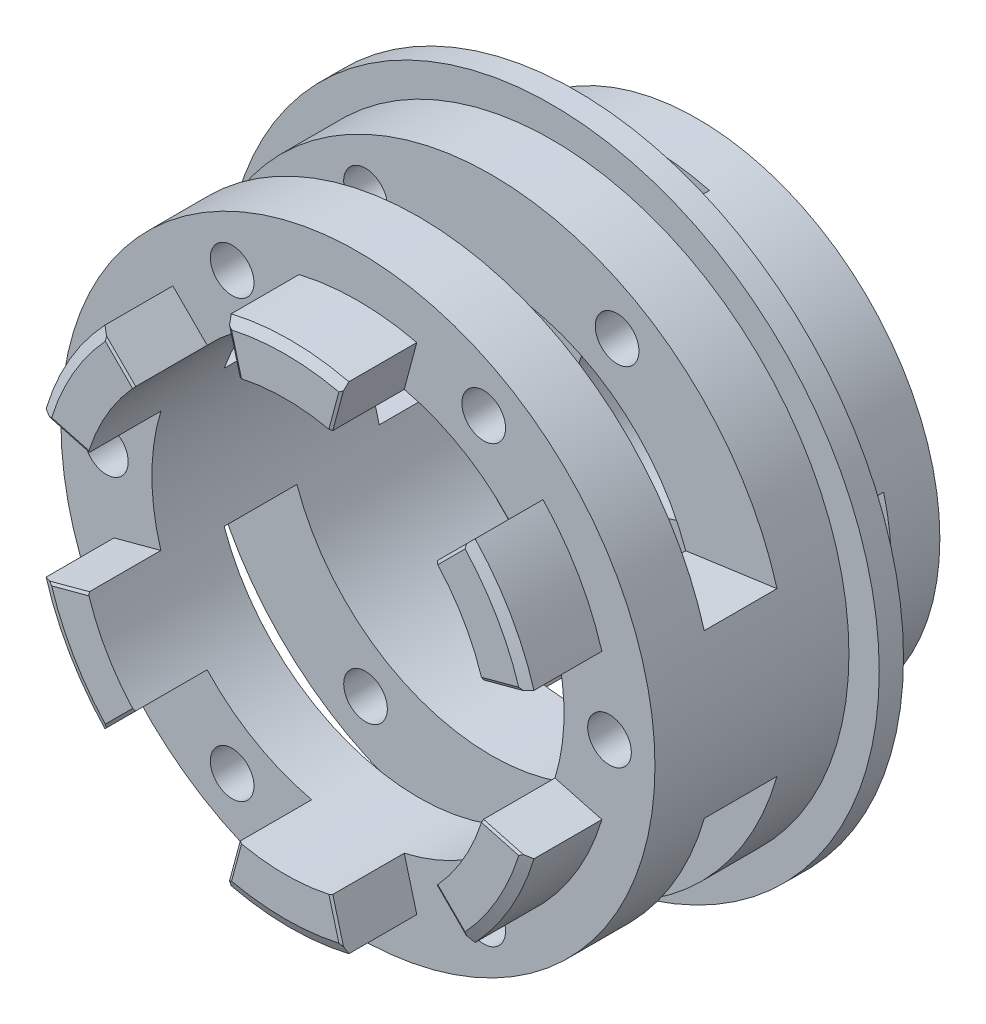
from build123d import *
from OCP.BRepFilletAPI import BRepFilletAPI_MakeChamfer

# Parameters (mm, degrees)
SKETCH_1_R               = 10
EXTRUDE_1_DEPTH          = 2
SKETCH_2_R               = 10
SKETCH_2_R_2             = 8.5
EXTRUDE_2_DEPTH          = 3
SKETCH_4_R               = 13.5
SKETCH_4_R_2             = 8.5
EXTRUDE_3_DEPTH          = 1
SKETCH_5_R               = 12.25
SKETCH_5_R_2             = 8.5
EXTRUDE_4_DEPTH          = 8
SKETCH_6_R               = 0.9
CUT_EXTRUDE_1_DEPTH      = 8
SKETCH_7_R               = 3
SKETCH_7_R_2             = 1.15
CUT_EXTRUDE_2_DEPTH      = 24.674881204
CUT_EXTRUDE_3_DEPTH      = 24.674881204
CUT_EXTRUDE_3_DEPTH_BACK = 24.674881204
SKETCH_8_W               = 5
SKETCH_8_H               = 3
CUT_EXTRUDE_4_DEPTH      = 24.674881204
CUT_EXTRUDE_4_DEPTH_BACK = 24.674881204
SKETCH_9_W               = 3
SKETCH_9_H               = 5
EXTRUDE_5_DEPTH          = 3
CHAMFER_1_SIZE           = 0.2
CHAMFER_1_SIZE2          = 0.410060768
CUT_EXTRUDE1_DEPTH       = 28
CUT_EXTRUDE2_DEPTH       = 1.5
CUT_EXTRUDE2_DEPTH_BACK  = 1.5


with BuildPart() as part:
    # 스케치1 → 보스-돌출1 (new body)
    with BuildSketch(Plane.XY):
        Circle(SKETCH_1_R)
    extrude(amount=EXTRUDE_1_DEPTH)

    # 스케치2 → 보스-돌출2 (add)
    with BuildSketch(Plane.XY.offset(2)):
        Circle(SKETCH_2_R)
        Circle(SKETCH_2_R_2, mode=Mode.SUBTRACT)
    extrude(amount=EXTRUDE_2_DEPTH)

    # 스케치4 → 보스-돌출3 (add)
    with BuildSketch(Plane.XY.offset(5)):
        Circle(SKETCH_4_R)
        Circle(SKETCH_4_R_2, mode=Mode.SUBTRACT)
    extrude(amount=EXTRUDE_3_DEPTH)

    # 스케치5 → 보스-돌출4 (add)
    with BuildSketch(Plane.XY.offset(6)):
        Circle(SKETCH_5_R)
        Circle(SKETCH_5_R_2, mode=Mode.SUBTRACT)
    extrude(amount=EXTRUDE_4_DEPTH)

    # 스케치6 → 컷-돌출1 (cut)
    with BuildSketch(Plane.XY.offset(14)):
        with Locations((10.375, 0)):
            Circle(SKETCH_6_R)
        with Locations((5.1875, -8.985013564)):
            Circle(SKETCH_6_R)
        with Locations((-5.1875, -8.985013564)):
            Circle(SKETCH_6_R)
        with Locations((-10.375, 0)):
            Circle(SKETCH_6_R)
        with Locations((-5.1875, 8.985013564)):
            Circle(SKETCH_6_R)
        with Locations((5.1875, 8.985013564)):
            Circle(SKETCH_6_R)
    extrude(amount=-CUT_EXTRUDE_1_DEPTH, mode=Mode.SUBTRACT)

    # 스케치7 → 컷-돌출2 (cut, through all)
    with BuildSketch(Plane(origin=(0, 0, 0), x_dir=(-1, 0, 0), z_dir=(0, 0, -1))):
        Circle(SKETCH_7_R)
        with Locations((-7, 0)):
            Circle(SKETCH_7_R_2)
        with Locations((7, 0)):
            Circle(SKETCH_7_R_2)
        with Locations((0, 7)):
            Circle(SKETCH_7_R_2)
        with Locations((0, -7)):
            Circle(SKETCH_7_R_2)
    extrude(amount=-CUT_EXTRUDE_2_DEPTH, mode=Mode.SUBTRACT)

    # 스케치8 → 컷-돌출3 (cut, two sides: drawn at the far end of the back side and taken through both)
    with BuildSketch(Plane(origin=(0, 0, 0), x_dir=(1, 0, 0), z_dir=(0, 1, 0)).offset(-CUT_EXTRUDE_3_DEPTH_BACK)):
        with Locations((0, -3.5)):
            Rectangle(SKETCH_8_W, SKETCH_8_H)
    extrude(amount=CUT_EXTRUDE_3_DEPTH + CUT_EXTRUDE_3_DEPTH_BACK, mode=Mode.SUBTRACT)

    # 스케치9 → 컷-돌출4 (cut, two sides: drawn at the far end of the back side and taken through both)
    with BuildSketch(Plane(origin=(0, 0, 0), x_dir=(0, 0, -1), z_dir=(1, 0, 0)).offset(-CUT_EXTRUDE_4_DEPTH_BACK)):
        with Locations((-3.5, 0)):
            Rectangle(SKETCH_9_W, SKETCH_9_H)
    extrude(amount=CUT_EXTRUDE_4_DEPTH + CUT_EXTRUDE_4_DEPTH_BACK, mode=Mode.SUBTRACT)

    # 스케치10 → 보스-돌출5 (add)
    with BuildSketch(Plane.XY.offset(14)):
        with BuildLine():
            Line((2.199961883, 8.210369523), (2.717599974, 10.142221176))
            ThreePointArc((2.717599974, 10.142221176), (0, 10.5), (-2.717599974, 10.142221176))
            Line((-2.717599974, 10.142221176), (-2.199961883, 8.210369523))
            ThreePointArc((-2.199961883, 8.210369523), (0, 8.5), (2.199961883, 8.210369523))
        make_face()
        with BuildLine():
            Line((6.01040764, 6.01040764), (7.424621202, 7.424621202))
            ThreePointArc((7.424621202, 7.424621202), (9.09326674, 5.25), (10.142221176, 2.717599974))
            Line((10.142221176, 2.717599974), (8.210369523, 2.199961883))
            ThreePointArc((8.210369523, 2.199961883), (7.361215932, 4.25), (6.01040764, 6.01040764))
        make_face()
        with BuildLine():
            Line((8.210369523, -2.199961883), (10.142221176, -2.717599974))
            ThreePointArc((10.142221176, -2.717599974), (9.09326674, -5.25), (7.424621202, -7.424621202))
            Line((7.424621202, -7.424621202), (6.01040764, -6.01040764))
            ThreePointArc((6.01040764, -6.01040764), (7.361215932, -4.25), (8.210369523, -2.199961883))
        make_face()
        with BuildLine():
            Line((2.199961883, -8.210369523), (2.717599974, -10.142221176))
            ThreePointArc((2.717599974, -10.142221176), (0, -10.5), (-2.717599974, -10.142221176))
            Line((-2.717599974, -10.142221176), (-2.199961883, -8.210369523))
            ThreePointArc((-2.199961883, -8.210369523), (0, -8.5), (2.199961883, -8.210369523))
        make_face()
        with BuildLine():
            Line((-6.01040764, -6.01040764), (-7.424621202, -7.424621202))
            ThreePointArc((-7.424621202, -7.424621202), (-9.09326674, -5.25), (-10.142221176, -2.717599974))
            Line((-10.142221176, -2.717599974), (-8.210369523, -2.199961883))
            ThreePointArc((-8.210369523, -2.199961883), (-7.361215932, -4.25), (-6.01040764, -6.01040764))
        make_face()
        with BuildLine():
            Line((-8.210369523, 2.199961883), (-10.142221176, 2.717599974))
            ThreePointArc((-10.142221176, 2.717599974), (-9.09326674, 5.25), (-7.424621202, 7.424621202))
            Line((-7.424621202, 7.424621202), (-6.01040764, 6.01040764))
            ThreePointArc((-6.01040764, 6.01040764), (-7.361215932, 4.25), (-8.210369523, 2.199961883))
        make_face()
    extrude(amount=EXTRUDE_5_DEPTH)

    # 모따기1: one chamfer whose edges measure the first distance from different faces: ONE call of the kernel's chamfer builder (chamfer() names one face for all edges)
    chamfer_1_edges_1 = [part.edges().sort_by_distance(p)[0] for p in [
        (-6.717514421, 6.717514421, 17),
    ]]
    chamfer_1_side_1 = [part.faces().sort_by_distance(p)[0] for p in [
        (-6.717514421, 6.717514421, 15.5),
    ]]
    chamfer_1_edges_2 = [part.edges().sort_by_distance(p)[0] for p in [
        (-9.09326674, 5.25, 17),
    ]]
    chamfer_1_side_2 = [part.faces().sort_by_distance(p)[0] for p in [
        (-9.09326674, 5.25, 15.5),
    ]]
    chamfer_1_edges_3 = [part.edges().sort_by_distance(p)[0] for p in [
        (-9.17629535, 2.458780928, 17),
    ]]
    chamfer_1_side_3 = [part.faces().sort_by_distance(p)[0] for p in [
        (-9.17629535, 2.458780928, 15.5),
    ]]
    chamfer_1_edges_4 = [part.edges().sort_by_distance(p)[0] for p in [
        (-9.17629535, -2.458780928, 17),
    ]]
    chamfer_1_side_4 = [part.faces().sort_by_distance(p)[0] for p in [
        (-9.17629535, -2.458780928, 15.5),
    ]]
    chamfer_1_edges_5 = [part.edges().sort_by_distance(p)[0] for p in [
        (-9.09326674, -5.25, 17),
    ]]
    chamfer_1_side_5 = [part.faces().sort_by_distance(p)[0] for p in [
        (-9.09326674, -5.25, 15.5),
    ]]
    chamfer_1_edges_6 = [part.edges().sort_by_distance(p)[0] for p in [
        (-6.717514421, -6.717514421, 17),
    ]]
    chamfer_1_side_6 = [part.faces().sort_by_distance(p)[0] for p in [
        (-6.717514421, -6.717514421, 15.5),
    ]]
    chamfer_1_edges_7 = [part.edges().sort_by_distance(p)[0] for p in [
        (0, 10.5, 17),
    ]]
    chamfer_1_side_7 = [part.faces().sort_by_distance(p)[0] for p in [
        (0, 10.5, 15.5),
    ]]
    chamfer_1_edges_8 = [part.edges().sort_by_distance(p)[0] for p in [
        (-2.458780928, 9.17629535, 17),
    ]]
    chamfer_1_side_8 = [part.faces().sort_by_distance(p)[0] for p in [
        (-2.458780928, 9.17629535, 15.5),
    ]]
    chamfer_1_edges_9 = [part.edges().sort_by_distance(p)[0] for p in [
        (2.458780928, 9.17629535, 17),
    ]]
    chamfer_1_side_9 = [part.faces().sort_by_distance(p)[0] for p in [
        (2.458780928, 9.17629535, 15.5),
    ]]
    chamfer_1_edges_10 = [part.edges().sort_by_distance(p)[0] for p in [
        (-2.458780928, -9.17629535, 17),
    ]]
    chamfer_1_side_10 = [part.faces().sort_by_distance(p)[0] for p in [
        (-2.458780928, -9.17629535, 15.5),
    ]]
    chamfer_1_edges_11 = [part.edges().sort_by_distance(p)[0] for p in [
        (0, -10.5, 17),
    ]]
    chamfer_1_side_11 = [part.faces().sort_by_distance(p)[0] for p in [
        (0, -10.5, 15.5),
    ]]
    chamfer_1_edges_12 = [part.edges().sort_by_distance(p)[0] for p in [
        (2.458780928, -9.17629535, 17),
    ]]
    chamfer_1_side_12 = [part.faces().sort_by_distance(p)[0] for p in [
        (2.458780928, -9.17629535, 15.5),
    ]]
    chamfer_1_edges_13 = [part.edges().sort_by_distance(p)[0] for p in [
        (9.09326674, 5.25, 17),
    ]]
    chamfer_1_side_13 = [part.faces().sort_by_distance(p)[0] for p in [
        (9.09326674, 5.25, 15.5),
    ]]
    chamfer_1_edges_14 = [part.edges().sort_by_distance(p)[0] for p in [
        (6.717514421, 6.717514421, 17),
    ]]
    chamfer_1_side_14 = [part.faces().sort_by_distance(p)[0] for p in [
        (6.717514421, 6.717514421, 15.5),
    ]]
    chamfer_1_edges_15 = [part.edges().sort_by_distance(p)[0] for p in [
        (9.17629535, 2.458780928, 17),
    ]]
    chamfer_1_side_15 = [part.faces().sort_by_distance(p)[0] for p in [
        (9.17629535, 2.458780928, 15.5),
    ]]
    chamfer_1_edges_16 = [part.edges().sort_by_distance(p)[0] for p in [
        (6.717514421, -6.717514421, 17),
    ]]
    chamfer_1_side_16 = [part.faces().sort_by_distance(p)[0] for p in [
        (6.717514421, -6.717514421, 15.5),
    ]]
    chamfer_1_edges_17 = [part.edges().sort_by_distance(p)[0] for p in [
        (9.09326674, -5.25, 17),
    ]]
    chamfer_1_side_17 = [part.faces().sort_by_distance(p)[0] for p in [
        (9.09326674, -5.25, 15.5),
    ]]
    chamfer_1_edges_18 = [part.edges().sort_by_distance(p)[0] for p in [
        (9.17629535, -2.458780928, 17),
    ]]
    chamfer_1_side_18 = [part.faces().sort_by_distance(p)[0] for p in [
        (9.17629535, -2.458780928, 15.5),
    ]]
    chamfer_1 = BRepFilletAPI_MakeChamfer(part.part.solid().wrapped)
    for e in chamfer_1_edges_1:
        chamfer_1.Add(CHAMFER_1_SIZE, CHAMFER_1_SIZE2, e.wrapped, chamfer_1_side_1[0].wrapped)  # the first distance lies on this face
    for e in chamfer_1_edges_2:
        chamfer_1.Add(CHAMFER_1_SIZE, CHAMFER_1_SIZE2, e.wrapped, chamfer_1_side_2[0].wrapped)  # the first distance lies on this face
    for e in chamfer_1_edges_3:
        chamfer_1.Add(CHAMFER_1_SIZE, CHAMFER_1_SIZE2, e.wrapped, chamfer_1_side_3[0].wrapped)  # the first distance lies on this face
    for e in chamfer_1_edges_4:
        chamfer_1.Add(CHAMFER_1_SIZE, CHAMFER_1_SIZE2, e.wrapped, chamfer_1_side_4[0].wrapped)  # the first distance lies on this face
    for e in chamfer_1_edges_5:
        chamfer_1.Add(CHAMFER_1_SIZE, CHAMFER_1_SIZE2, e.wrapped, chamfer_1_side_5[0].wrapped)  # the first distance lies on this face
    for e in chamfer_1_edges_6:
        chamfer_1.Add(CHAMFER_1_SIZE, CHAMFER_1_SIZE2, e.wrapped, chamfer_1_side_6[0].wrapped)  # the first distance lies on this face
    for e in chamfer_1_edges_7:
        chamfer_1.Add(CHAMFER_1_SIZE, CHAMFER_1_SIZE2, e.wrapped, chamfer_1_side_7[0].wrapped)  # the first distance lies on this face
    for e in chamfer_1_edges_8:
        chamfer_1.Add(CHAMFER_1_SIZE, CHAMFER_1_SIZE2, e.wrapped, chamfer_1_side_8[0].wrapped)  # the first distance lies on this face
    for e in chamfer_1_edges_9:
        chamfer_1.Add(CHAMFER_1_SIZE, CHAMFER_1_SIZE2, e.wrapped, chamfer_1_side_9[0].wrapped)  # the first distance lies on this face
    for e in chamfer_1_edges_10:
        chamfer_1.Add(CHAMFER_1_SIZE, CHAMFER_1_SIZE2, e.wrapped, chamfer_1_side_10[0].wrapped)  # the first distance lies on this face
    for e in chamfer_1_edges_11:
        chamfer_1.Add(CHAMFER_1_SIZE, CHAMFER_1_SIZE2, e.wrapped, chamfer_1_side_11[0].wrapped)  # the first distance lies on this face
    for e in chamfer_1_edges_12:
        chamfer_1.Add(CHAMFER_1_SIZE, CHAMFER_1_SIZE2, e.wrapped, chamfer_1_side_12[0].wrapped)  # the first distance lies on this face
    for e in chamfer_1_edges_13:
        chamfer_1.Add(CHAMFER_1_SIZE, CHAMFER_1_SIZE2, e.wrapped, chamfer_1_side_13[0].wrapped)  # the first distance lies on this face
    for e in chamfer_1_edges_14:
        chamfer_1.Add(CHAMFER_1_SIZE, CHAMFER_1_SIZE2, e.wrapped, chamfer_1_side_14[0].wrapped)  # the first distance lies on this face
    for e in chamfer_1_edges_15:
        chamfer_1.Add(CHAMFER_1_SIZE, CHAMFER_1_SIZE2, e.wrapped, chamfer_1_side_15[0].wrapped)  # the first distance lies on this face
    for e in chamfer_1_edges_16:
        chamfer_1.Add(CHAMFER_1_SIZE, CHAMFER_1_SIZE2, e.wrapped, chamfer_1_side_16[0].wrapped)  # the first distance lies on this face
    for e in chamfer_1_edges_17:
        chamfer_1.Add(CHAMFER_1_SIZE, CHAMFER_1_SIZE2, e.wrapped, chamfer_1_side_17[0].wrapped)  # the first distance lies on this face
    for e in chamfer_1_edges_18:
        chamfer_1.Add(CHAMFER_1_SIZE, CHAMFER_1_SIZE2, e.wrapped, chamfer_1_side_18[0].wrapped)  # the first distance lies on this face
    add(Compound.cast(chamfer_1.Shape()), mode=Mode.REPLACE)

    # Sketch1 → Cut-Extrude1 (cut)
    with BuildSketch(Plane.XY.offset(14)):
        Polygon((-1.810450153, 7.915802947), (-5.481642099, 5.05737803), (-8.346954939, 7.92269087), (-2.521428309, 10.569209549), align=None)
        Polygon((-8.024658224, 2.460783545), (-7.634763962, -2.356311692), (-10.630124095, -3.158916021), (-10.534699141, 3.133346982), align=None)
        Polygon((-5.900110023, -5.475845954), (-1.784744072, -7.819866548), (-2.556356452, -10.699563151), (-7.904253722, -7.479989654), align=None)
        Polygon((1.844696422, -8.043611764), (5.641653521, -5.217389452), (7.95973846, -7.535474391), (2.556459055, -10.699946072), align=None)
        Polygon((7.438698098, -2.303776002), (7.63540584, 2.356483683), (10.467440175, 3.115324996), (10.594945273, -3.149489884), align=None)
        Polygon((5.988701722, 5.564437653), (1.812744218, 7.924364514), (2.528807519, 10.596749137), (7.932238358, 7.507974289), align=None)
    extrude(amount=CUT_EXTRUDE1_DEPTH, mode=Mode.SUBTRACT)

    # Sketch2 → Cut-Extrude2 (cut, two sides: drawn at the far end of the back side and taken through both)
    with BuildSketch(Plane.XY.offset(10).offset(-CUT_EXTRUDE2_DEPTH_BACK)):
        Polygon((0, 1.698145606), (-22.472595471, 4.853129123), (-22.472595471, 17.03925296), (22.472595471, 17.03925296), (22.472595471, 4.853129123), align=None)
        Polygon((0, -1.698145606), (-22.472595471, -4.853129123), (-22.472595471, -17.03925296), (22.472595471, -17.03925296), (22.472595471, -4.853129123), align=None)
    extrude(amount=CUT_EXTRUDE2_DEPTH + CUT_EXTRUDE2_DEPTH_BACK, mode=Mode.SUBTRACT)


solid = part.part
